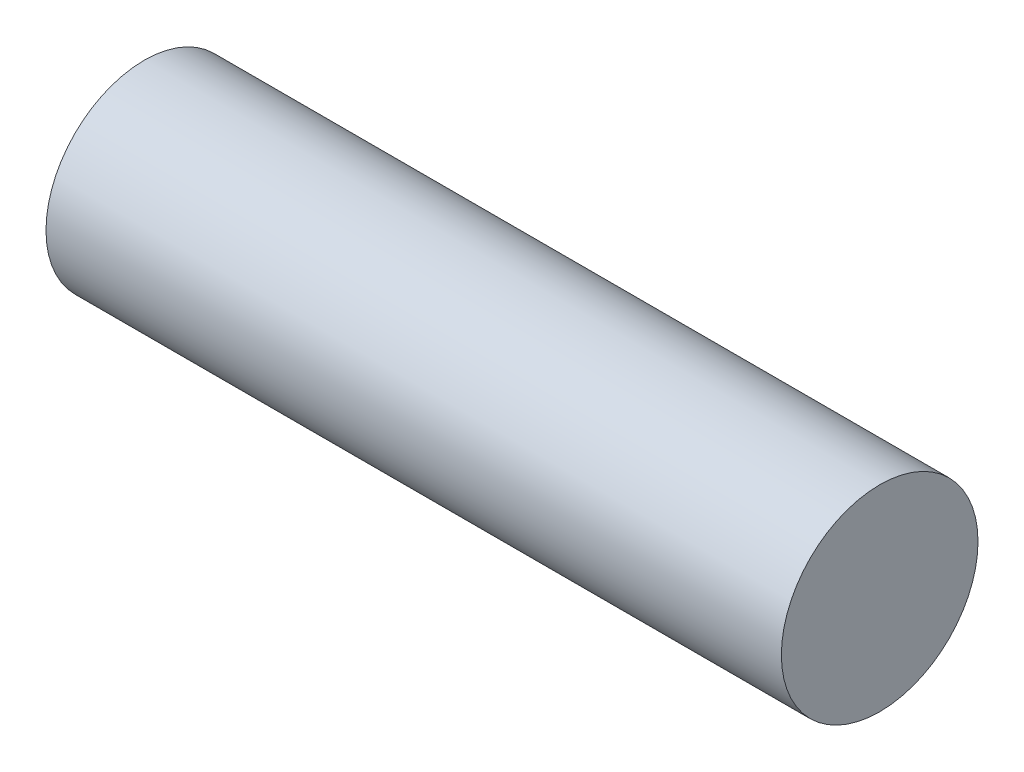
from build123d import *

# Parameters (mm, degrees)
SKETCH1_R           = 4
BOSS_EXTRUDE1_DEPTH = 29.92


with BuildPart() as part:
    # Sketch1 → Boss-Extrude1 (new body)
    with BuildSketch(Plane(origin=(0, 0, 0), x_dir=(0, 0, -1), z_dir=(1, 0, 0))):
        Circle(SKETCH1_R)
    extrude(amount=BOSS_EXTRUDE1_DEPTH)


solid = part.part
